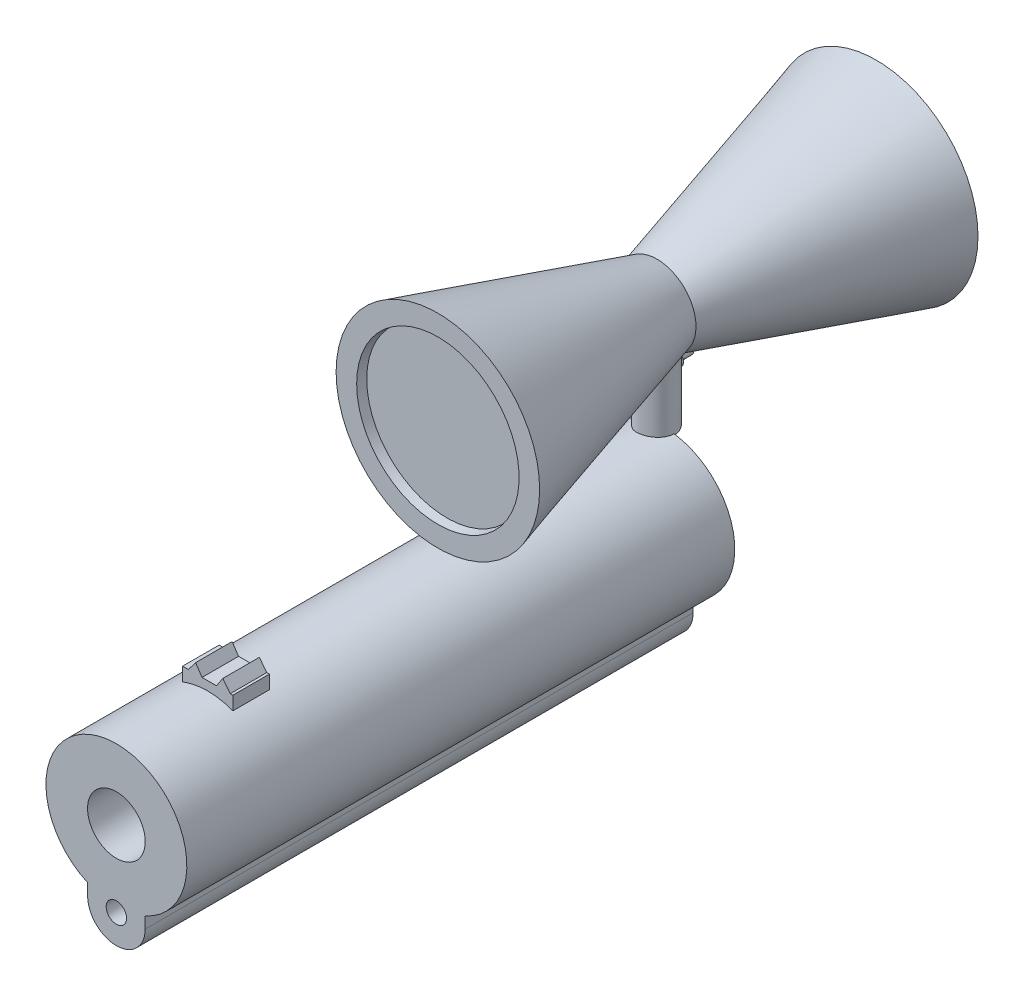
from build123d import *

# Parameters (mm, degrees)
SKETCH1_R           = 15.427757536
SKETCH1_R_2         = 6.316623128
BOSS_EXTRUDE1_DEPTH = 120
SKETCH2_R           = 2.232947937
CUT_EXTRUDE1_DEPTH  = 124.133145307
BOSS_EXTRUDE2_DEPTH = 8
SKETCH4_R           = 8.525514215
BOSS_EXTRUDE3_DEPTH = 48
BOSS_EXTRUDE3_DRAFT = -16
SKETCH6_R           = 17.788526435
CUT_EXTRUDE2_DEPTH  = 2
CUT_EXTRUDE2_DRAFT  = -6
SKETCH9_R           = 3.851191152
BOSS_EXTRUDE4_DEPTH = 17
SKETCH10_R          = 1.742885096
BOSS_EXTRUDE5_DEPTH = 8
SKETCH11_R          = 0.9231432
BOSS_EXTRUDE6_DEPTH = 3


with BuildPart() as part:
    # Sketch1 → Boss-Extrude1 (new body)
    # profile 1 of 2: a face of its own
    with BuildSketch(Plane.XY):
        with BuildLine():
            ThreePointArc((6.300172561, -14.082738665), (0, -15.427757536), (-6.300172561, -14.082738665))
            Line((-6.300172561, -14.082738665), (-6.300172561, -16.585538494))
            ThreePointArc((-6.300172561, -16.585538494), (0, -22.885711055), (6.300172561, -16.585538494))
            Line((6.300172561, -16.585538494), (6.300172561, -14.082738665))
        make_face()
    # profile 2 of 2: a face of its own
    with BuildSketch(Plane.XY):
        Circle(SKETCH1_R)
        Circle(SKETCH1_R_2, mode=Mode.SUBTRACT)
    extrude(amount=-BOSS_EXTRUDE1_DEPTH)

    # Sketch2 → Cut-Extrude1 (cut, through all)
    with BuildSketch(Plane.XY):
        with Locations((0, -16.585538494)):
            Circle(SKETCH2_R)
    extrude(amount=-CUT_EXTRUDE1_DEPTH, mode=Mode.SUBTRACT)

    # Sketch3 → Boss-Extrude2 (add)
    with BuildSketch(Plane.XY.offset(-20)):
        Polygon((-5.507367926, 14.411266465), (-5.507367926, 17.381711903), (-4.2414169, 17.381711903), (-2.659812694, 19.470864473), (-1.2414169, 17.381711903), (1.925005593, 17.381711903), (3.311155437, 19.470864473), (4.925005593, 17.381711903), (5.507367926, 17.381711903), (5.507367926, 14.411266465), align=None)
    extrude(amount=-BOSS_EXTRUDE2_DEPTH)



with BuildPart() as body_2:
    # Sketch4 → Boss-Extrude3 (with draft: the straight prism first)
    with BuildSketch(Plane(origin=(0, 0, -120), x_dir=(-1, 0, 0), z_dir=(0, 0, -1))):
        with Locations((1.595997464, 38.007665121)):
            Circle(SKETCH4_R)
    extrude(amount=BOSS_EXTRUDE3_DEPTH)
    # Boss-Extrude3: the draft: its side faces are tilted about the plane it starts from
    boss_extrude3_sides = [body_2.faces().sort_by_distance(p)[0] for p in [
        (6.929516751, 38.007665121, -144),
    ]]
    draft(boss_extrude3_sides, Plane(origin=(0, 0, -120), x_dir=(-1, 0, 0), z_dir=(0, 0, -1)), BOSS_EXTRUDE3_DRAFT)


with BuildPart() as cut_extrude2_tool:
    # Sketch6 → Cut-Extrude2 (with draft: the straight prism first)
    with BuildSketch(Plane(origin=(0, 0, -168), x_dir=(-1, 0, 0), z_dir=(0, 0, -1))):
        with Locations((1.595997464, 38.007665121)):
            Circle(SKETCH6_R)
    extrude(amount=-CUT_EXTRUDE2_DEPTH)
    # Cut-Extrude2: the draft: its side faces are tilted about the plane it starts from
    cut_extrude2_sides = [cut_extrude2_tool.faces().sort_by_distance(p)[0] for p in [
        (16.192528971, 38.007665121, -167),
    ]]
    draft(cut_extrude2_sides, Plane(origin=(0, 0, -168), x_dir=(-1, 0, 0), z_dir=(0, 0, -1)), CUT_EXTRUDE2_DRAFT)


with BuildPart() as body_2_1:
    add(body_2.part)

    # Cut-Extrude2: cut by cut_extrude2_tool
    add(cut_extrude2_tool.part, mode=Mode.SUBTRACT)


with BuildPart() as body_3:
    # Mirror2: mirrored copy
    add(body_2_1.part.mirror(Plane(origin=(-1.595997464, 38.007665121, -120), x_dir=(1, 0, 0), z_dir=(0, 0, -1))))


with BuildPart() as part_1:
    add(part.part)

    add(body_2_1.part)  # Boss-Extrude4 merges body 2

    add(body_3.part)  # Boss-Extrude4 merges body 3
    # Sketch9 → Boss-Extrude4 (add)
    with BuildSketch(Plane(origin=(0, 15, 0), x_dir=(1, 0, 0), z_dir=(0, 1, 0))):
        with Locations((-1.723427255, 120)):
            Circle(SKETCH9_R)
    extrude(amount=BOSS_EXTRUDE4_DEPTH)

    # Sketch10 → Boss-Extrude5 (add)
    with BuildSketch(Plane(origin=(0, 0, -120), x_dir=(-1, 0, 0), z_dir=(0, 0, -1))):
        with Locations(Location((5.539882161, 21.928787469, 0), (0, 0, 88.858001541))):
            Circle(SKETCH10_R)
    extrude(amount=BOSS_EXTRUDE5_DEPTH)

    # Sketch11 → Boss-Extrude6 (add)
    with BuildSketch(Plane(origin=(0, 0, -128), x_dir=(-1, 0, 0), z_dir=(0, 0, -1))):
        with Locations((5.539882161, 21.928787469)):
            Circle(SKETCH11_R)
    extrude(amount=BOSS_EXTRUDE6_DEPTH)


solid = part_1.part
